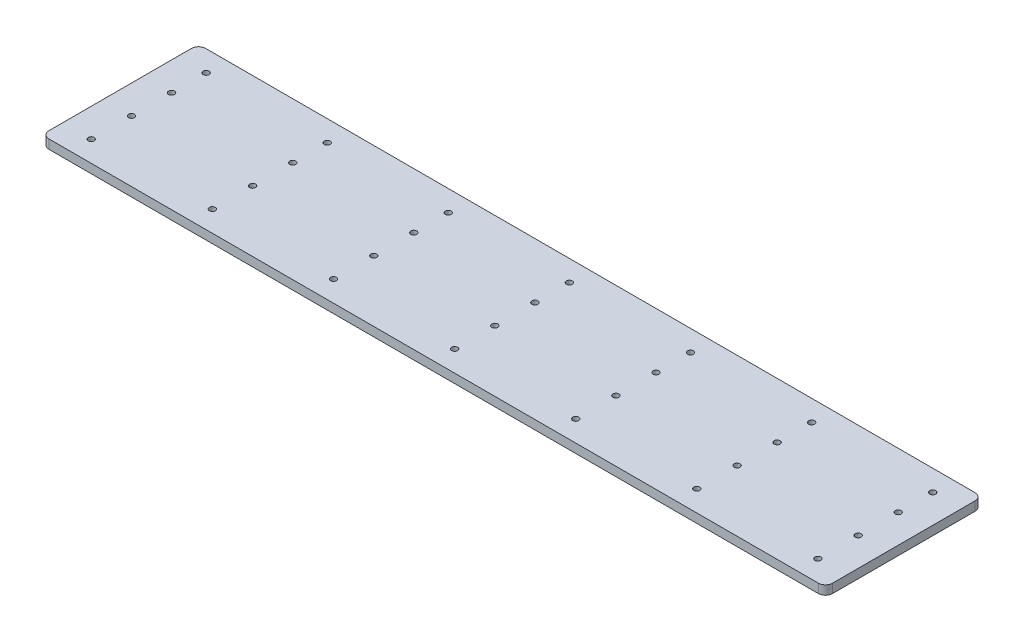
from build123d import *

# Parameters (mm, degrees)
SKETCH1_W                   = 550
SKETCH1_H                   = 110
BOSS_EXTRUDE1_DEPTH         = 6.35
TAP_DRILL_FOR_M5X0_8_TAP1_D = 4.2
LPATTERN1_COUNT             = 4
LPATTERN1_PITCH             = 85
LPATTERN1_COL_COUNT         = 4
LPATTERN1_COL_PITCH         = 85
FILLET1_R                   = 5


with BuildPart() as part:
    # Sketch1 → Boss-Extrude1 (new body)
    with BuildSketch(Plane(origin=(0, 0, 0), x_dir=(1, 0, 0), z_dir=(0, 1, 0))):
        Rectangle(SKETCH1_W, SKETCH1_H)
    extrude(amount=-BOSS_EXTRUDE1_DEPTH)

    # Tap Drill for M5x0.8 Tap1 (through all)
    with Locations(Plane(origin=(0, 0, -40.299), x_dir=(0, 0, 1), z_dir=(0, 1, 0))):
        with Locations((0, 0), (24.2295, 0), (52.3435, 0), (80.598, 0)):
            tap_drill_for_m5x0_8_tap1 = Hole(TAP_DRILL_FOR_M5X0_8_TAP1_D / 2)

    # LPattern1: Tap Drill for M5x0.8 Tap1 ×4
    with Locations(*[(i * LPATTERN1_PITCH, 0, 0) for i in range(1, LPATTERN1_COUNT)]):
        add(tap_drill_for_m5x0_8_tap1, mode=Mode.SUBTRACT)

    # LPattern1 col: Tap Drill for M5x0.8 Tap1 ×4
    with Locations(*[(-i * LPATTERN1_COL_PITCH, 0, 0) for i in range(1, LPATTERN1_COL_COUNT)]):
        add(tap_drill_for_m5x0_8_tap1, mode=Mode.SUBTRACT)

    # Fillet1
    fillet1_edges = [part.edges().sort_by_distance(p)[0] for p in [
        (-275, -3.175, -55),
        (275, -3.175, -55),
        (275, -3.175, 55),
        (-275, -3.175, 55),
    ]]
    fillet(fillet1_edges, radius=FILLET1_R)


solid = part.part
